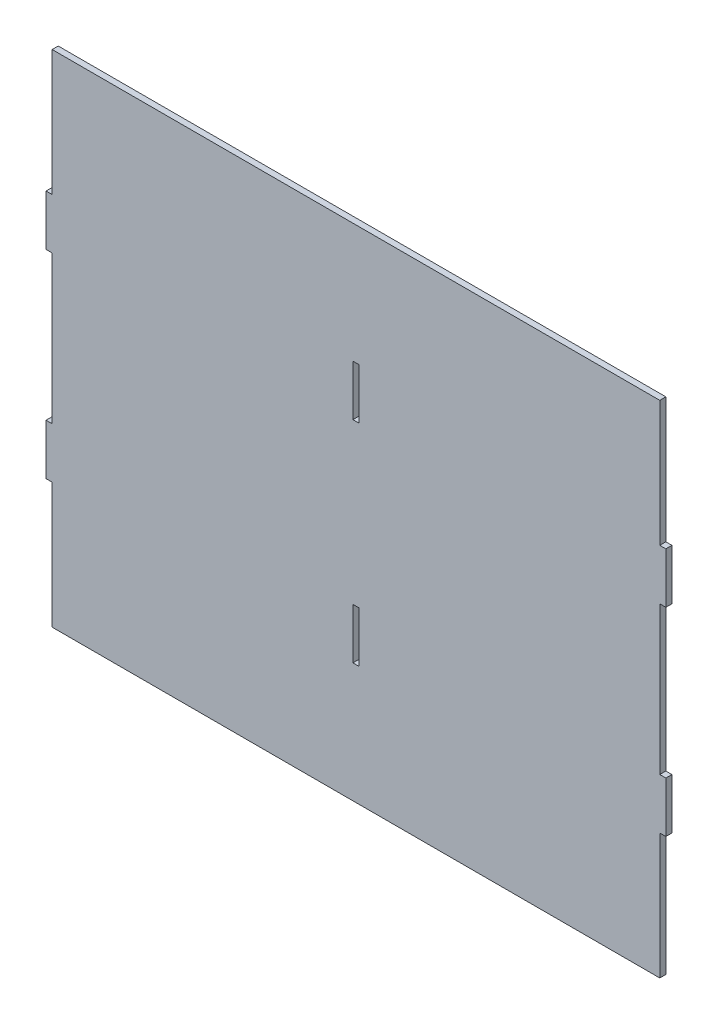
from build123d import *

# Parameters (mm, degrees)
SKETCH1_W           = 6
SKETCH1_H           = 50
BOSS_EXTRUDE1_DEPTH = 6


with BuildPart() as part:
    # Sketch1 → Boss-Extrude1 (new body)
    with BuildSketch(Plane.XY):
        Polygon((-300, 247), (300, 247), (300, 123), (306, 123), (306, 73), (300, 73), (300, -73), (306, -73), (306, -123), (300, -123), (300, -247), (-300, -247), (-300, -123), (-306, -123), (-306, -73), (-300, -73), (-300, 73), (-306, 73), (-306, 123), (-300, 123), align=None)
        with Locations((0, 104)):
            Rectangle(SKETCH1_W, SKETCH1_H, mode=Mode.SUBTRACT)
        with Locations((0, -104)):
            Rectangle(SKETCH1_W, SKETCH1_H, mode=Mode.SUBTRACT)
    extrude(amount=BOSS_EXTRUDE1_DEPTH)


solid = part.part
